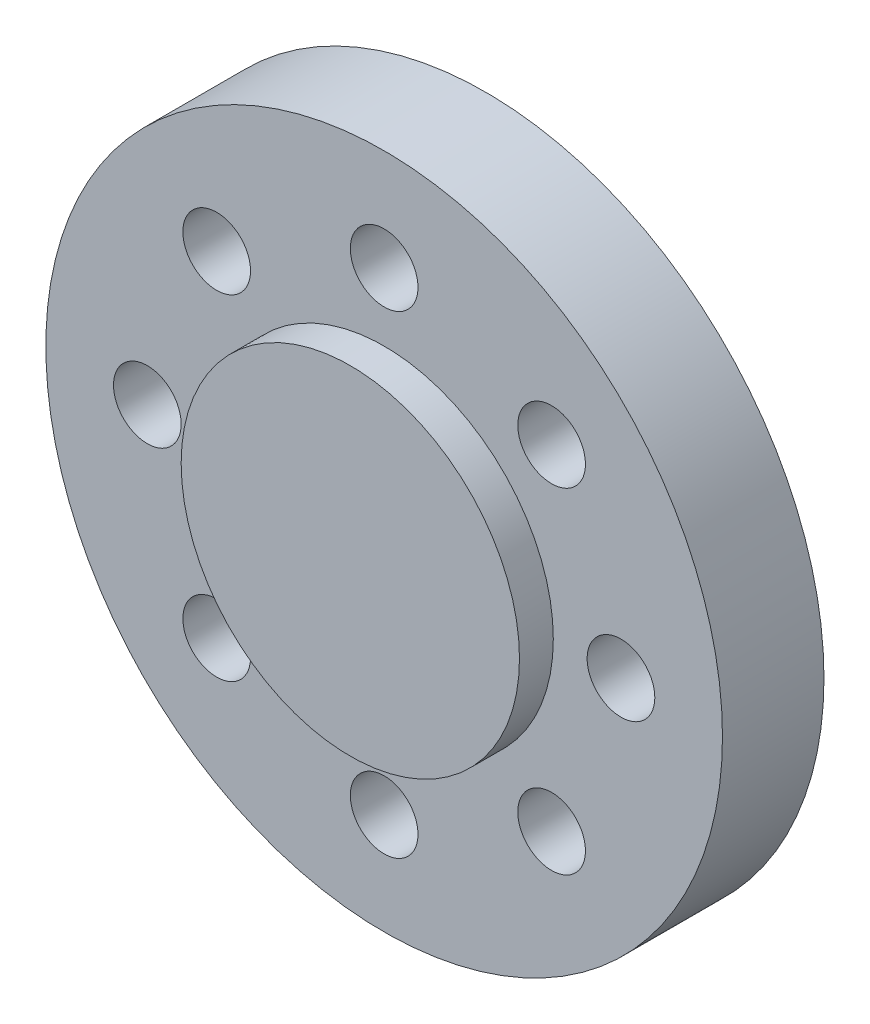
from build123d import *

# Parameters (mm, degrees)
SKETCH_1_R          = 1
EXTRUDE_1_DEPTH     = 32.5
SKETCH_2_R          = 3
EXTRUDE_2_DEPTH     = 3.5
SKETCH_3_R          = 10
EXTRUDE_3_DEPTH     = 3
SKETCH_4_R          = 5
EXTRUDE_4_DEPTH     = 1
SKETCH_5_R          = 1
CUT_EXTRUDE_1_DEPTH = 3
SKETCH_6_W          = 52.078633919
SKETCH_6_H          = 39.097037898
CUT_EXTRUDE_2_DEPTH = 32.5


with BuildPart() as part:
    # ｽｹｯﾁ1 → ﾎﾞｽ - 押し出し1 (new body)
    with BuildSketch(Plane.XY):
        with BuildLine():
            Line((-17.482907979, 4.845565749), (13.517092021, 4.845565749))
            ThreePointArc((13.517092021, 4.845565749), (20.100097265, 3.428570993), (25.517092021, -0.571429007))
            Line((25.517092021, -0.571429007), (25.517092021, -21.737439495))
            ThreePointArc((25.517092021, -21.737439495), (20.100097265, -25.737439495), (13.517092021, -27.154434251))
            Line((13.517092021, -27.154434251), (-17.482907979, -27.154434251))
            Line((-17.482907979, -27.154434251), (-17.482907979, 4.845565749))
        make_face()
        with Locations((-14.482907979, -24.654434251)):
            Circle(SKETCH_1_R, mode=Mode.SUBTRACT)
        with Locations((12.517092021, -24.654434251)):
            Circle(SKETCH_1_R, mode=Mode.SUBTRACT)
        with Locations((12.517092021, 2.345565749)):
            Circle(SKETCH_1_R, mode=Mode.SUBTRACT)
        with Locations((-14.482907979, 2.345565749)):
            Circle(SKETCH_1_R, mode=Mode.SUBTRACT)
    extrude(amount=EXTRUDE_1_DEPTH)

    # ｽｹｯﾁ2 → ﾎﾞｽ - 押し出し2 (add)
    with BuildSketch(Plane.XY.offset(32.5)):
        with Locations((13.517092021, -11.154434251)):
            Circle(SKETCH_2_R)
    extrude(amount=EXTRUDE_2_DEPTH)

    # ｽｹｯﾁ3 → ﾎﾞｽ - 押し出し3 (add)
    with BuildSketch(Plane.XY.offset(36)):
        with Locations((13.517092021, -11.154434251)):
            Circle(SKETCH_3_R)
    extrude(amount=-EXTRUDE_3_DEPTH)

    # ｽｹｯﾁ4 → ﾎﾞｽ - 押し出し4 (add)
    with BuildSketch(Plane.XY.offset(36)):
        with Locations((13.517092021, -11.154434251)):
            Circle(SKETCH_4_R)
    extrude(amount=EXTRUDE_4_DEPTH)

    # ｽｹｯﾁ5 → ｶｯﾄ - 押し出し1 (cut)
    with BuildSketch(Plane.XY.offset(36)):
        with Locations((20.517092021, -11.154434251)):
            Circle(SKETCH_5_R)
        with Locations((18.466839489, -16.104181719)):
            Circle(SKETCH_5_R)
        with Locations((13.517092021, -18.154434251)):
            Circle(SKETCH_5_R)
        with Locations((8.567344553, -16.104181719)):
            Circle(SKETCH_5_R)
        with Locations((6.517092021, -11.154434251)):
            Circle(SKETCH_5_R)
        with Locations((8.567344553, -6.204686782)):
            Circle(SKETCH_5_R)
        with Locations((13.517092021, -4.154434251)):
            Circle(SKETCH_5_R)
        with Locations((18.466839489, -6.204686782)):
            Circle(SKETCH_5_R)
    extrude(amount=-CUT_EXTRUDE_1_DEPTH, mode=Mode.SUBTRACT)

    # ｽｹｯﾁ6 → ｶｯﾄ - 押し出し2 (cut)
    with BuildSketch(Plane(origin=(0, 0, 0), x_dir=(-1, 0, 0), z_dir=(0, 0, -1))):
        with Locations((-8.556408981, -7.605915302)):
            Rectangle(SKETCH_6_W, SKETCH_6_H)
    extrude(amount=-CUT_EXTRUDE_2_DEPTH, mode=Mode.SUBTRACT)


solid = part.part
